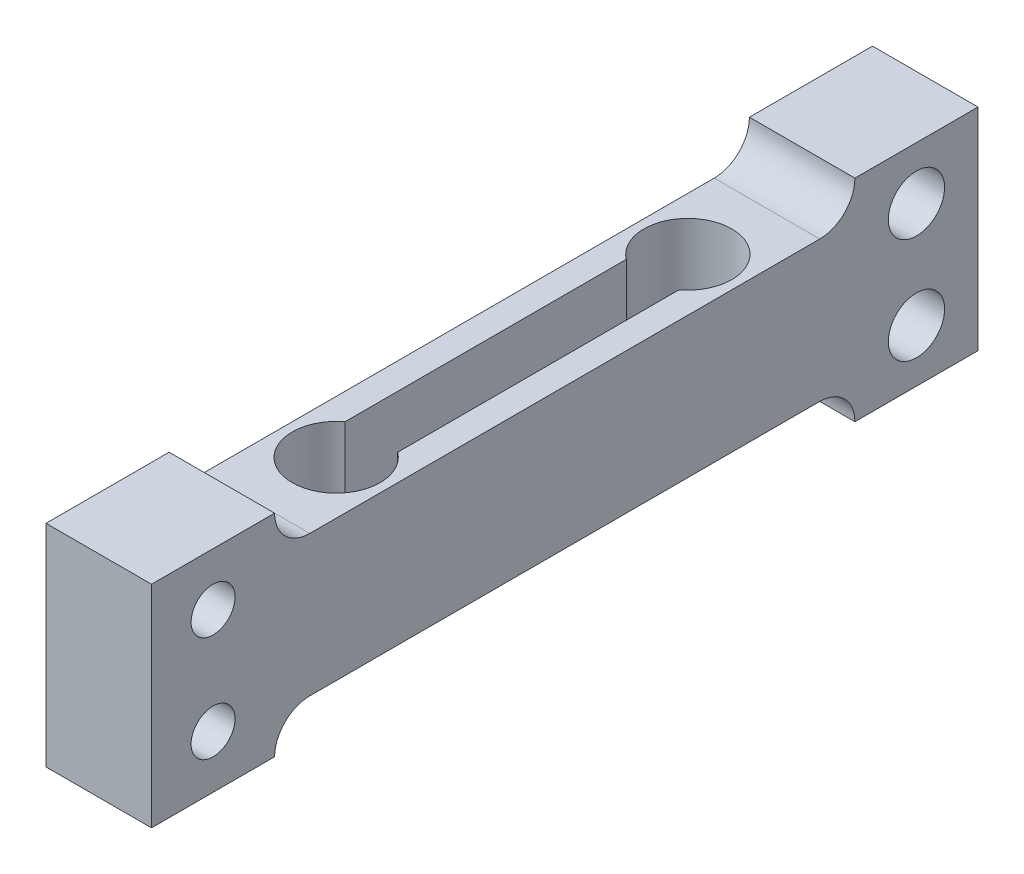
from build123d import *

# Parameters (mm, degrees)
SKETCH1_W                 = 47
SKETCH1_H                 = 12
BOSS_EXTRUDE1_DEPTH       = 6
CUT_EXTRUDE2_DEPTH        = 25.984995497
SKETCH4_R                 = 1.6
CUT_EXTRUDE3_DEPTH        = 25.984995497
M3X0_5_TAPPED_HOLE1_D     = 2.5
M3X0_5_TAPPED_HOLE1_DEPTH = 7.5
M3X0_5_TAPPED_HOLE1_TIP   = 0.751075774
CUT_EXTRUDE4_DEPTH        = 27.234519245


with BuildPart() as part:
    # Sketch1 → Boss-Extrude1 (new body)
    with BuildSketch(Plane(origin=(0, 0, 0), x_dir=(0, 0, -1), z_dir=(1, 0, 0))):
        Rectangle(SKETCH1_W, SKETCH1_H)
    extrude(amount=BOSS_EXTRUDE1_DEPTH)

    # Sketch3 → Cut-Extrude2 (cut, through all)
    with BuildSketch(Plane(origin=(6, 0, 0), x_dir=(0, 0, -1), z_dir=(1, 0, 0))):
        with BuildLine():
            Line((16.5, 6), (-16.5, 6))
            ThreePointArc((-16.5, 6), (-15.914213562, 4.585786438), (-14.5, 4))
            Line((-14.5, 4), (14.5, 4))
            ThreePointArc((14.5, 4), (15.914213562, 4.585786438), (16.5, 6))
        make_face()
        with BuildLine():
            Line((-14.5, -4), (14.5, -4))
            ThreePointArc((14.5, -4), (15.914213562, -4.585786438), (16.5, -6))
            Line((16.5, -6), (-16.5, -6))
            ThreePointArc((-16.5, -6), (-15.914213562, -4.585786438), (-14.5, -4))
        make_face()
    extrude(amount=-CUT_EXTRUDE2_DEPTH, mode=Mode.SUBTRACT)

    # Sketch4 → Cut-Extrude3 (cut, through all)
    with BuildSketch(Plane(origin=(6, 0, 0), x_dir=(0, 0, -1), z_dir=(1, 0, 0))):
        with Locations((20, 3)):
            Circle(SKETCH4_R)
        with Locations((20, -3)):
            Circle(SKETCH4_R)
    extrude(amount=-CUT_EXTRUDE3_DEPTH, mode=Mode.SUBTRACT)

    # M3x0.5 Tapped Hole1
    with Locations(Plane(origin=(6, 0, 0), x_dir=(0, 0, -1), z_dir=(1, 0, 0))):
        with Locations((-20, 3), (-20, -3)):
            Hole(M3X0_5_TAPPED_HOLE1_D / 2, depth=M3X0_5_TAPPED_HOLE1_DEPTH)
            with Locations((0, 0, -(M3X0_5_TAPPED_HOLE1_DEPTH + M3X0_5_TAPPED_HOLE1_TIP / 2))):  # 118° drill point
                Cone(0, M3X0_5_TAPPED_HOLE1_D / 2, M3X0_5_TAPPED_HOLE1_TIP, mode=Mode.SUBTRACT)

    # Sketch8 → Cut-Extrude4 (cut, through all)
    with BuildSketch(Plane.XZ.offset(4)):
        with BuildLine():
            Line((4.5, 8), (4.5, -8))
            ThreePointArc((4.5, -8), (3, -12.5), (1.5, -8))
            Line((1.5, -8), (1.5, 8))
            ThreePointArc((1.5, 8), (3, 12.5), (4.5, 8))
        make_face()
    extrude(amount=-CUT_EXTRUDE4_DEPTH, mode=Mode.SUBTRACT)


solid = part.part
